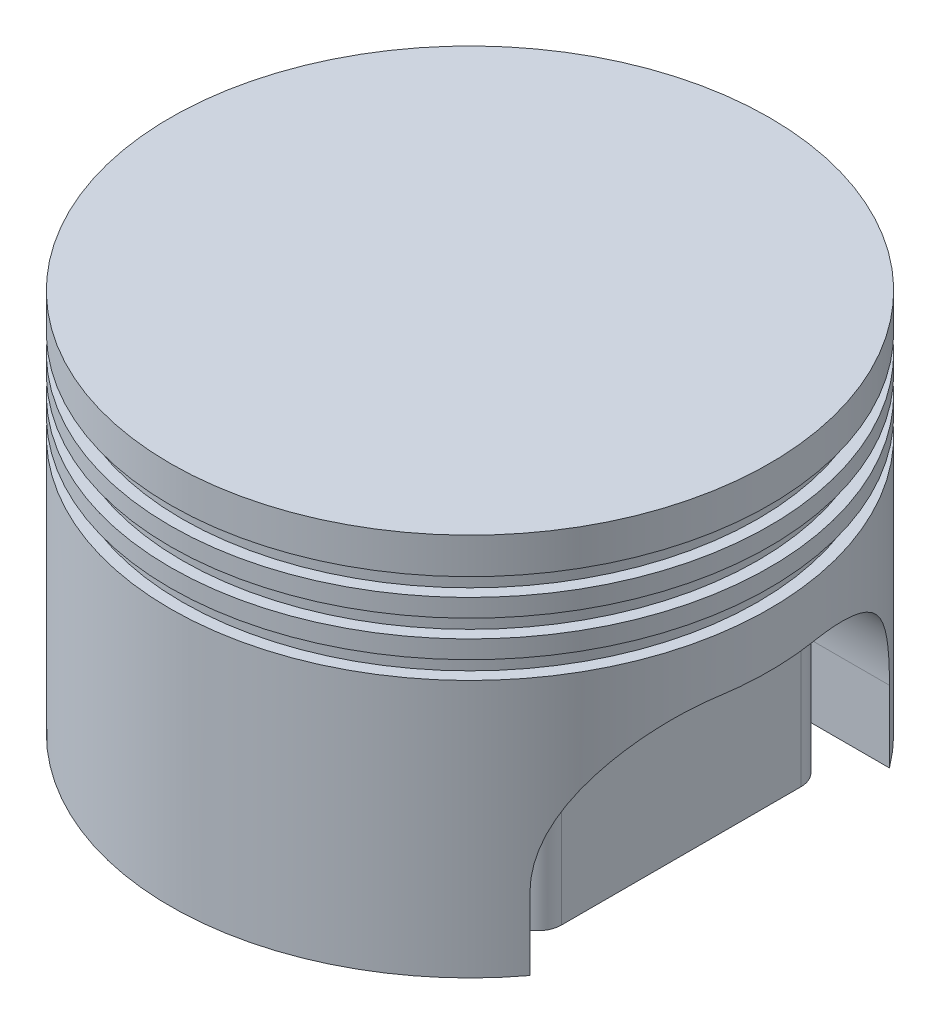
from build123d import *

# Parameters (mm, degrees)
CUT_EXTRUDE2_DEPTH  = 158
SKETCH5_W           = 14.178939879
SKETCH5_H           = 3.81
SKETCH5_W_2         = 9.359777066
BOSS_EXTRUDE3_DEPTH = 43.18


with BuildPart() as part:
    # Sketch2 → Revolve4 (revolve)
    with BuildSketch(Plane.XY, mode=Mode.PRIVATE) as revolve4_sk:
        Polygon((0, 0), (-63.5, 0), (-63.5, -81.28), (-37.7, -81.28), (-37.7, -38.1), (0, -38.1), align=None)
    revolve(revolve4_sk.sketch.rotate(Axis((0, -38.1, 0), (0, 1, 0)), 270), axis=Axis((0, -38.1, 0), (0, 1, 0)))

    # Sketch3 → Cut-Extrude2 (cut)
    with BuildSketch(Plane.ZY.offset(63.5)):
        with BuildLine():
            Line((10.1, -38.1), (-10.1, -38.1))
            ThreePointArc((-10.1, -38.1), (-29.898989873, -46.301010127), (-38.1, -66.1))
            Line((-38.1, -66.1), (-38.1, -81.28))
            Line((-38.1, -81.28), (0, -81.28))
            Line((0, -81.28), (38.1, -81.28))
            Line((38.1, -81.28), (38.1, -66.1))
            ThreePointArc((38.1, -66.1), (29.898989873, -46.301010127), (10.1, -38.1))
        make_face()
    extrude(amount=-CUT_EXTRUDE2_DEPTH, mode=Mode.SUBTRACT)

    # Sketch5 → Cut-Revolve6 (revolve, cut)
    with BuildSketch(Plane(origin=(0, 0, 0), x_dir=(0, 0, -1), z_dir=(1, 0, 0)), mode=Mode.PRIVATE) as cut_revolve6_sk:
        with Locations((68.08946994, -9.525)):
            Rectangle(SKETCH5_W, SKETCH5_H)
        with Locations((65.679888533, -17.145)):
            Rectangle(SKETCH5_W_2, SKETCH5_H)
        with Locations((65.679888533, -24.765)):
            Rectangle(SKETCH5_W_2, SKETCH5_H)
    revolve(cut_revolve6_sk.sketch.rotate(Axis((0, 0, 0), (0, -1, 0)), 306.869897646), axis=Axis((0, 0, 0), (0, -1, 0)), mode=Mode.SUBTRACT)

    # Sketch6 → Boss-Extrude3 (add)
    # profile 1 of 2: a face of its own
    with BuildSketch(Plane(origin=(0, -38.1, 0), x_dir=(1, 0, 0), z_dir=(0, 1, 0))):
        with BuildLine():
            Line((15.879627523, -25.508764572), (15.879627523, 25.291235428))
            ThreePointArc((15.879627523, 25.291235428), (17.344093617, 28.826769334), (20.879627523, 30.291235428))
            Line((20.879627523, 30.291235428), (39.879627523, 30.291235428))
            ThreePointArc((39.879627523, 30.291235428), (43.415161429, 28.826769334), (44.879627523, 25.291235428))
            Line((44.879627523, 25.291235428), (44.879627523, -25.508764572))
            ThreePointArc((44.879627523, -25.508764572), (43.415161429, -29.044298478), (39.879627523, -30.508764572))
            Line((39.879627523, -30.508764572), (20.879627523, -30.508764572))
            ThreePointArc((20.879627523, -30.508764572), (17.344093617, -29.044298478), (15.879627523, -25.508764572))
        make_face()
        with BuildLine():
            Line((20.879627523, -20.508764572), (20.879627523, 20.291235428))
            ThreePointArc((20.879627523, 20.291235428), (22.344093617, 23.826769334), (25.879627523, 25.291235428))
            Line((25.879627523, 25.291235428), (34.879627523, 25.291235428))
            ThreePointArc((34.879627523, 25.291235428), (38.415161429, 23.826769334), (39.879627523, 20.291235428))
            Line((39.879627523, 20.291235428), (39.879627523, -20.508764572))
            ThreePointArc((39.879627523, -20.508764572), (38.415161429, -24.044298478), (34.879627523, -25.508764572))
            Line((34.879627523, -25.508764572), (25.879627523, -25.508764572))
            ThreePointArc((25.879627523, -25.508764572), (22.344093617, -24.044298478), (20.879627523, -20.508764572))
        make_face(mode=Mode.SUBTRACT)
    # profile 2 of 2: a face of its own
    with BuildSketch(Plane(origin=(0, -38.1, 0), x_dir=(1, 0, 0), z_dir=(0, 1, 0))):
        with BuildLine():
            Line((-44.879627523, 25.291235428), (-44.879627523, -25.508764572))
            ThreePointArc((-44.879627523, -25.508764572), (-43.415161429, -29.044298478), (-39.879627523, -30.508764572))
            Line((-39.879627523, -30.508764572), (-20.879627523, -30.508764572))
            ThreePointArc((-20.879627523, -30.508764572), (-17.344093617, -29.044298478), (-15.879627523, -25.508764572))
            Line((-15.879627523, -25.508764572), (-15.879627523, 25.291235428))
            ThreePointArc((-15.879627523, 25.291235428), (-17.344093617, 28.826769334), (-20.879627523, 30.291235428))
            Line((-20.879627523, 30.291235428), (-39.879627523, 30.291235428))
            ThreePointArc((-39.879627523, 30.291235428), (-43.415161429, 28.826769334), (-44.879627523, 25.291235428))
        make_face()
        with BuildLine():
            Line((-39.879627523, 20.291235428), (-39.879627523, -20.508764572))
            ThreePointArc((-39.879627523, -20.508764572), (-38.415161429, -24.044298478), (-34.879627523, -25.508764572))
            Line((-34.879627523, -25.508764572), (-25.879627523, -25.508764572))
            ThreePointArc((-25.879627523, -25.508764572), (-22.344093617, -24.044298478), (-20.879627523, -20.508764572))
            Line((-20.879627523, -20.508764572), (-20.879627523, 20.291235428))
            ThreePointArc((-20.879627523, 20.291235428), (-22.344093617, 23.826769334), (-25.879627523, 25.291235428))
            Line((-25.879627523, 25.291235428), (-34.879627523, 25.291235428))
            ThreePointArc((-34.879627523, 25.291235428), (-38.415161429, 23.826769334), (-39.879627523, 20.291235428))
        make_face(mode=Mode.SUBTRACT)
    extrude(amount=-BOSS_EXTRUDE3_DEPTH)


solid = part.part
